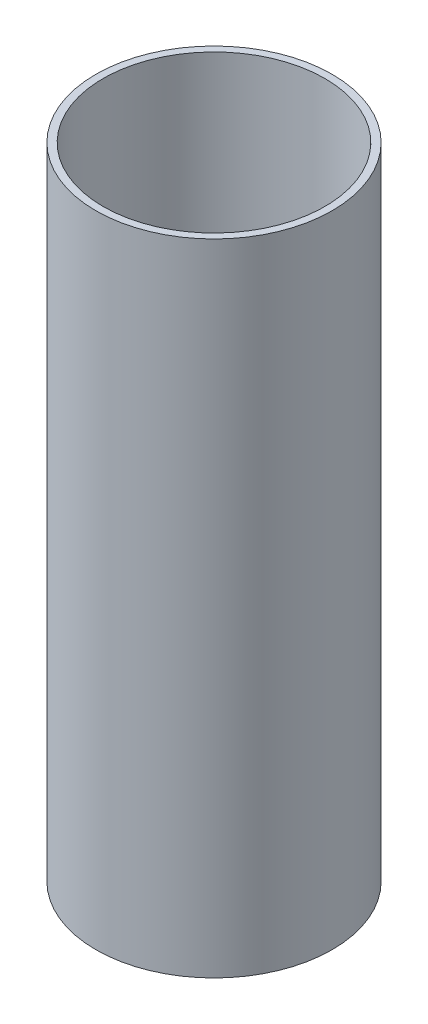
from build123d import *

# Parameters (mm, degrees)
SKETCH1_W = 3.175
SKETCH1_H = 279.4


with BuildPart() as part:
    # Sketch1 → Revolve1 (revolve)
    with BuildSketch(Plane.XY, mode=Mode.PRIVATE) as revolve1_sk:
        with Locations((50.00625, 139.7)):
            Rectangle(SKETCH1_W, SKETCH1_H)
    revolve(revolve1_sk.sketch.rotate(Axis((0, -13.97, 0), (0, 1, 0)), 90), axis=Axis((0, -13.97, 0), (0, 1, 0)))


solid = part.part
